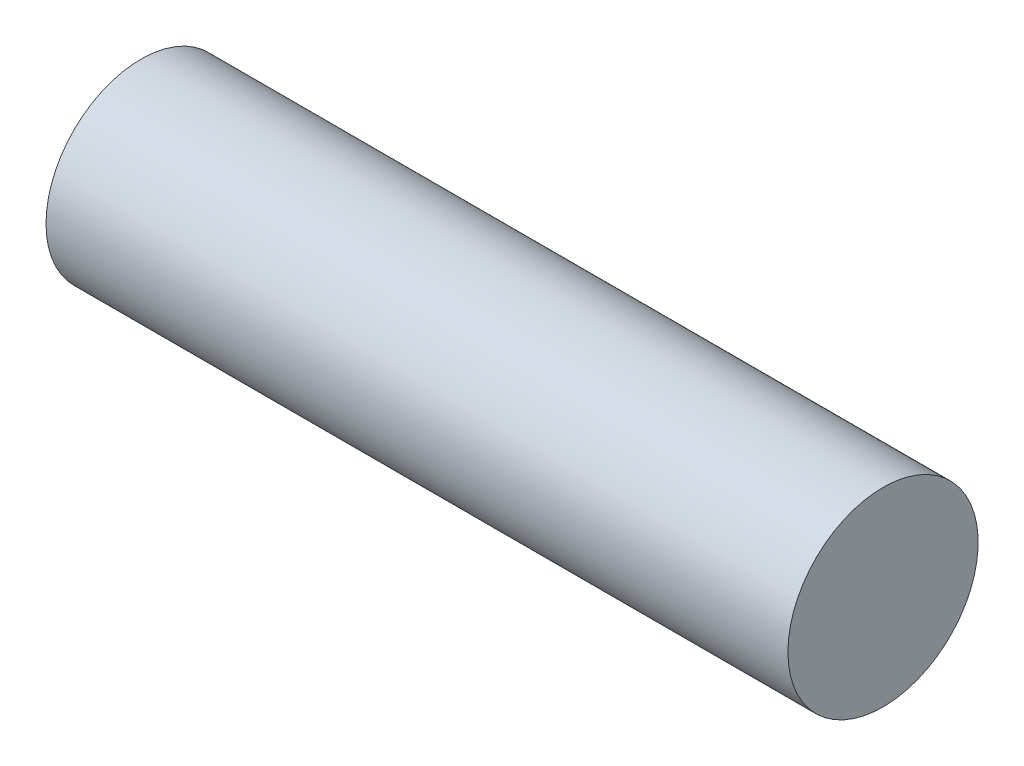
from build123d import *

# Parameters (mm, degrees)
SKETCH1_W = 24.765
SKETCH1_H = 3.175


with BuildPart() as part:
    # Sketch1 → Revolve1 (revolve)
    with BuildSketch(Plane(origin=(0, 0, 0), x_dir=(1, 0, 0), z_dir=(0, 1, 0))):
        with Locations((0, -1.5875)):
            Rectangle(SKETCH1_W, SKETCH1_H)
    revolve(axis=Axis((-12.3825, 0, 0), (1, 0, 0)))


solid = part.part
